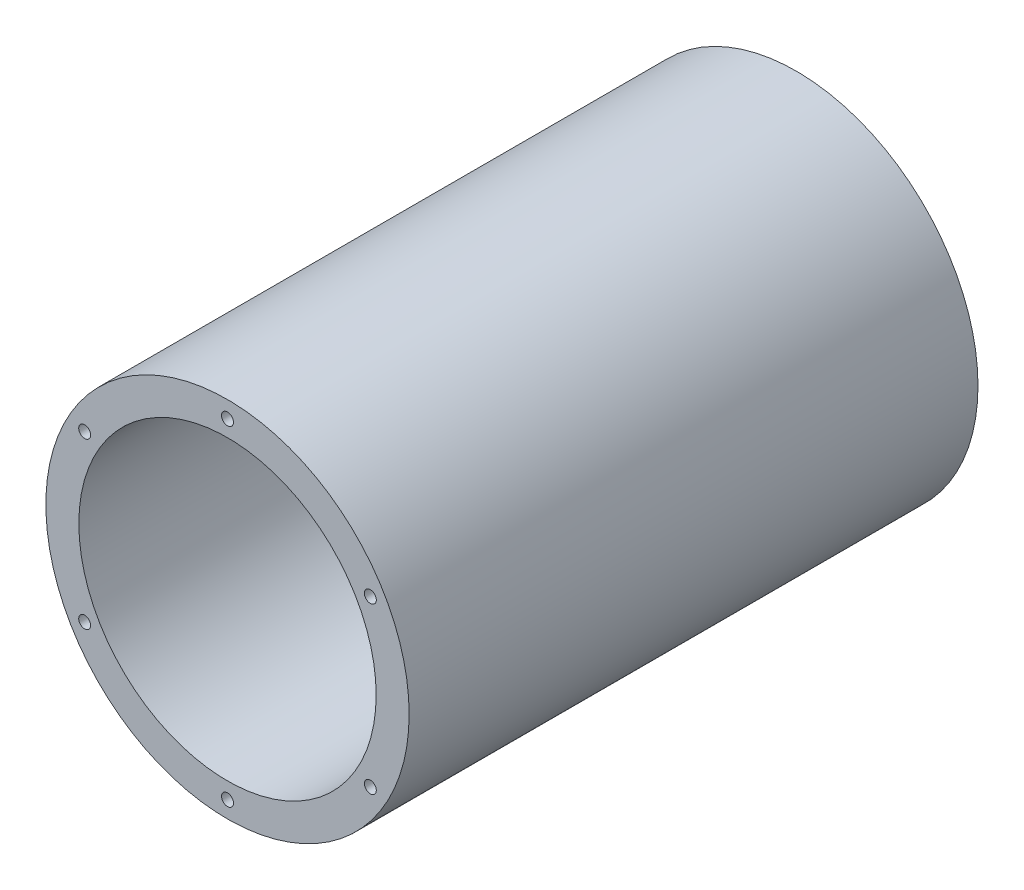
from build123d import *

# Parameters (mm, degrees)
SKETCH_1_R                  = 38
SKETCH_1_R_2                = 31.1
EXTRUDE_1_DEPTH             = 59.5
HOLE_WIZARD_M3_1_AT_2_COUNT = 2
HOLE_WIZARD_M3_1_AT_2_PITCH = 34.5
HOLE_WIZARD_M3_1_AT_3_COUNT = 2
HOLE_WIZARD_M3_1_AT_3_PITCH = 59.755752861
HOLE_WIZARD_M3_1_AT_4_COUNT = 2
HOLE_WIZARD_M3_1_AT_4_PITCH = 69
HOLE_WIZARD_M3_1_AT_5_COUNT = 2
HOLE_WIZARD_M3_1_AT_5_PITCH = 59.755752861
HOLE_WIZARD_M3_1_AT_6_COUNT = 2
HOLE_WIZARD_M3_1_AT_6_PITCH = 34.5


with BuildPart() as part:
    # 草图1 → 凸台-拉伸1 (new, symmetric)
    with BuildSketch(Plane.XY):
        Circle(SKETCH_1_R)
        Circle(SKETCH_1_R_2, mode=Mode.SUBTRACT)
    extrude(amount=EXTRUDE_1_DEPTH, both=True)

    # 草图2 → M3 螺纹孔1 (revolve, cut)
    with BuildSketch(Plane(origin=(0, 34.5, 59.5), x_dir=(0, -1, 0), z_dir=(1, 0, 0))):
        Polygon((0, 0), (0, 9.251075774), (1.25, 8.5), (1.25, 0), align=None)
    hole_wizard_m3_1 = revolve(axis=Axis((0, 34.5, 65.85), (0, 0, -1)), mode=Mode.SUBTRACT)

    # M3 螺纹孔1 at 2: M3 螺纹孔1 ×2
    with Locations(*[Vector(0.8660254037844671, -0.49999999999995076, 0) * (i * HOLE_WIZARD_M3_1_AT_2_PITCH) for i in range(1, HOLE_WIZARD_M3_1_AT_2_COUNT)]):
        add(hole_wizard_m3_1, mode=Mode.SUBTRACT)

    # M3 螺纹孔1 at 3: M3 螺纹孔1 ×2
    with Locations(*[Vector(0.5000000000000492, -0.8660254037844103, 0) * (i * HOLE_WIZARD_M3_1_AT_3_PITCH) for i in range(1, HOLE_WIZARD_M3_1_AT_3_COUNT)]):
        add(hole_wizard_m3_1, mode=Mode.SUBTRACT)

    # M3 螺纹孔1 at 4: M3 螺纹孔1 ×2
    with Locations(*[(0, -i * HOLE_WIZARD_M3_1_AT_4_PITCH, 0) for i in range(1, HOLE_WIZARD_M3_1_AT_4_COUNT)]):
        add(hole_wizard_m3_1, mode=Mode.SUBTRACT)

    # M3 螺纹孔1 at 5: M3 螺纹孔1 ×2
    with Locations(*[Vector(-0.49999999999995076, -0.866025403784467, 0) * (i * HOLE_WIZARD_M3_1_AT_5_PITCH) for i in range(1, HOLE_WIZARD_M3_1_AT_5_COUNT)]):
        add(hole_wizard_m3_1, mode=Mode.SUBTRACT)

    # M3 螺纹孔1 at 6: M3 螺纹孔1 ×2
    with Locations(*[Vector(-0.8660254037844105, -0.5000000000000487, 0) * (i * HOLE_WIZARD_M3_1_AT_6_PITCH) for i in range(1, HOLE_WIZARD_M3_1_AT_6_COUNT)]):
        add(hole_wizard_m3_1, mode=Mode.SUBTRACT)

    # 镜向1: M3 螺纹孔1 across plane
    add(hole_wizard_m3_1.mirror(Plane.XY), mode=Mode.SUBTRACT)

    # 镜向1 copy 1 sketch → 镜向1 copy 1 (revolve, cut)
    with BuildSketch(Plane(origin=(29.877876431, 17.25, -59.5), x_dir=(0, -1, 0), z_dir=(1, 0, 0))):
        Polygon((0, 0), (0, -9.251075774), (1.25, -8.5), (1.25, 0), align=None)
    revolve(axis=Axis((29.877876431, 17.25, -65.85), (0, 0, -1)), mode=Mode.SUBTRACT)

    # 镜向1 copy 2 sketch → 镜向1 copy 2 (revolve, cut)
    with BuildSketch(Plane(origin=(29.877876431, -17.25, -59.5), x_dir=(0, -1, 0), z_dir=(1, 0, 0))):
        Polygon((0, 0), (0, -9.251075774), (1.25, -8.5), (1.25, 0), align=None)
    revolve(axis=Axis((29.877876431, -17.25, -65.85), (0, 0, -1)), mode=Mode.SUBTRACT)

    # 镜向1 copy 3 sketch → 镜向1 copy 3 (revolve, cut)
    with BuildSketch(Plane(origin=(0, -34.5, -59.5), x_dir=(0, -1, 0), z_dir=(1, 0, 0))):
        Polygon((0, 0), (0, -9.251075774), (1.25, -8.5), (1.25, 0), align=None)
    revolve(axis=Axis((0, -34.5, -65.85), (0, 0, -1)), mode=Mode.SUBTRACT)

    # 镜向1 copy 4 sketch → 镜向1 copy 4 (revolve, cut)
    with BuildSketch(Plane(origin=(-29.877876431, -17.25, -59.5), x_dir=(0, -1, 0), z_dir=(1, 0, 0))):
        Polygon((0, 0), (0, -9.251075774), (1.25, -8.5), (1.25, 0), align=None)
    revolve(axis=Axis((-29.877876431, -17.25, -65.85), (0, 0, -1)), mode=Mode.SUBTRACT)

    # 镜向1 copy 5 sketch → 镜向1 copy 5 (revolve, cut)
    with BuildSketch(Plane(origin=(-29.877876431, 17.25, -59.5), x_dir=(0, -1, 0), z_dir=(1, 0, 0))):
        Polygon((0, 0), (0, -9.251075774), (1.25, -8.5), (1.25, 0), align=None)
    revolve(axis=Axis((-29.877876431, 17.25, -65.85), (0, 0, -1)), mode=Mode.SUBTRACT)


solid = part.part
